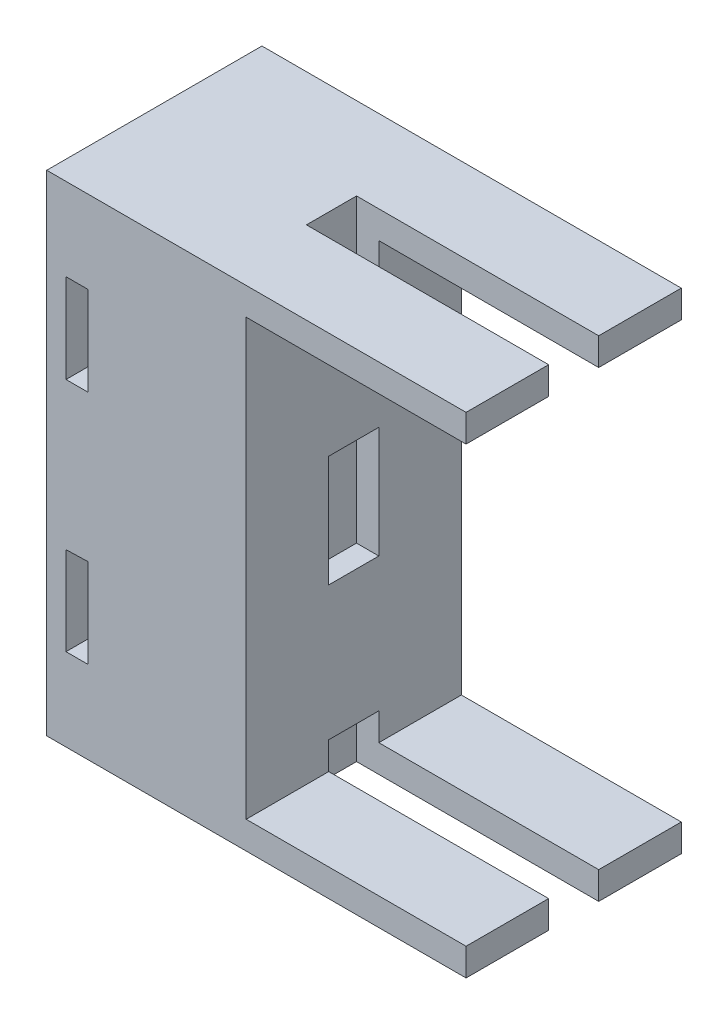
from build123d import *

# Parameters (mm, degrees)
SERVO_CLASPER_2ND_HALF_SERVO_A_DEPTH     = 7.62
CUTOUT_START                             = 7.62
CENTER_ENCAPSULATOR_W                    = 2.0574
CENTER_ENCAPSULATOR_H                    = 12.446
CENTER_ENCAPSULATOR_H_2                  = 12.377096657
CUTOUT_TO_HOLD_SERVO_DEPTH               = 4.6228
SERVO_START                              = 12.2428
SERVO_CLASPER_2ND_HALF_OTHER_SERVO_DEPTH = 7.62
SKETCH12_W                               = 19.8628
SKETCH12_H                               = 45.212
SERVO_HOLDER_EXTRUDE_DEPTH               = 16.350000066
SERVO_B_CUT_DEPTH                        = 7.62
SERVO_B_SECURER_CUT_DEPTH                = 49.383140951
SERVO_B_SECURER_CUT_DEPTH_BACK           = 49.383140951
SKETCH18_W                               = 2.032
SKETCH18_H                               = 8.21582812


with BuildPart() as part:
    # Sketch1 → Servo Clasper 2nd Half (Servo A) (new body)
    with BuildSketch(Plane.XY):
        Polygon((12.25510559, 35.312310559), (12.25510559, 32.772310559), (-8.03949441, 32.772310559), (-8.03949441, -7.359689441), (12.25510559, -7.359689441), (12.25510559, -9.899689441), (-10.09689441, -9.899689441), (-10.09689441, 35.312310559), align=None)
    extrude(amount=SERVO_CLASPER_2ND_HALF_SERVO_A_DEPTH)

    # center encapsulator → Cutout to hold servo (add)
    with BuildSketch(Plane.XY.offset(CUTOUT_START)):
        with Locations((-9.06819441, 24.072810559)):
            Rectangle(CENTER_ENCAPSULATOR_W, CENTER_ENCAPSULATOR_H)
        with Locations((-9.06819441, 1.374262231)):
            Rectangle(CENTER_ENCAPSULATOR_W, CENTER_ENCAPSULATOR_H_2)
    extrude(amount=CUTOUT_TO_HOLD_SERVO_DEPTH)

    # Sketch7 → Servo Clasper 2nd Half (Other Servo) (add)
    with BuildSketch(Plane.XY.offset(SERVO_START)):
        Polygon((12.25510559, 35.312310559), (12.25510559, 32.772310559), (-8.03949441, 32.772310559), (-8.03949441, -7.359689441), (12.25510559, -7.359689441), (12.25510559, -9.899689441), (-10.09689441, -9.899689441), (-10.09689441, 35.312310559), align=None)
    extrude(amount=SERVO_CLASPER_2ND_HALF_OTHER_SERVO_DEPTH)

    # Sketch12 → Servo Holder Extrude (add)
    with BuildSketch(Plane.ZY.offset(10.09689441)):
        with Locations((9.9314, 12.706310559)):
            Rectangle(SKETCH12_W, SKETCH12_H)
    extrude(amount=SERVO_HOLDER_EXTRUDE_DEPTH)

    # Sketch14 → Servo B Cut (cut)
    with BuildSketch(Plane.ZY.offset(26.446894476)):
        Polygon((7.29615, 29.470310559), (12.05865, 29.470310559), (14.1859, 14.687510559), (14.1859, 10.725110559), (12.05865, -4.057689441), (7.29615, -4.057689441), (5.1689, 10.725110559), (5.1689, 14.687510559), align=None)
    extrude(amount=-SERVO_B_CUT_DEPTH, mode=Mode.SUBTRACT)

    # Sketch18 → Servo B Securer Cut (cut, two sides: drawn at the far end of the back side and taken through both)
    with BuildSketch(Plane(origin=(0, 0, 0), x_dir=(-1, 0, 0), z_dir=(0, 0, -1)).offset(-SERVO_B_SECURER_CUT_DEPTH_BACK)):
        with Locations((23.652894476, 23.584396499)):
            Rectangle(SKETCH18_W, SKETCH18_H)
        Polygon((24.668894476, 5.874578093), (22.636894476, 5.936138467), (22.636894476, -2.279689441), (24.668894476, -2.279689441), align=None)
    extrude(amount=SERVO_B_SECURER_CUT_DEPTH + SERVO_B_SECURER_CUT_DEPTH_BACK, mode=Mode.SUBTRACT)


solid = part.part
